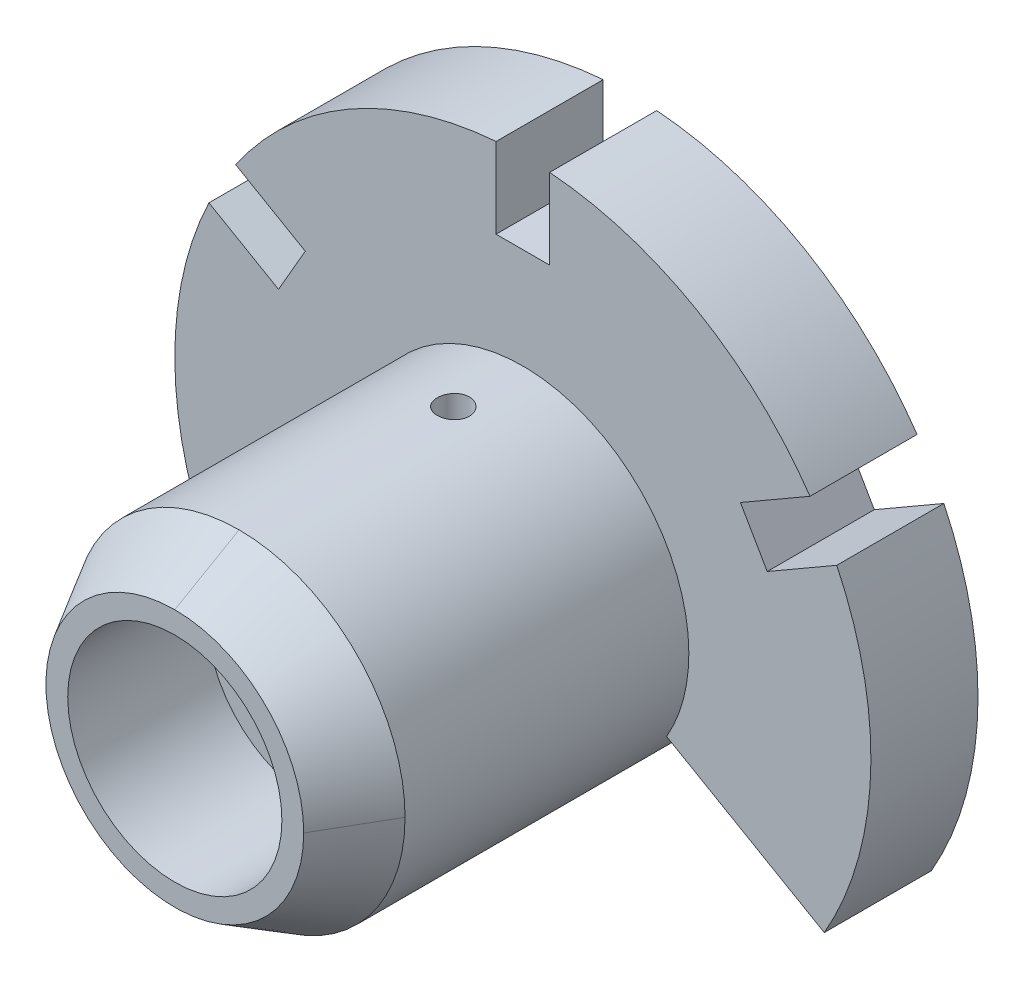
from build123d import *

# Parameters (mm, degrees)
BOSS_EXTRUDE1_DEPTH      = 20
BOSS_EXTRUDE2_DEPTH      = 65
BOSS_EXTRUDE2_DEPTH_BACK = 20
SKETCH3_R                = 31
SKETCH3_R_2              = 12.5
SKETCH6_R                = 20
CUT_EXTRUDE1_DEPTH       = 26
SKETCH8_R                = 12.5
CUT_EXTRUDE2_DEPTH       = 20
SKETCH9_R                = 3
CUT_EXTRUDE3_DEPTH       = 33


with BuildPart() as part:
    # Sketch2 → Boss-Extrude1 (new body)
    with BuildSketch(Plane.XY):
        with BuildLine():
            Line((0, 0), (56.291651246, -32.5))
            ThreePointArc((56.291651246, -32.5), (64.9518339, -2.501853916), (58.624860802, 28.073576473))
            Line((58.624860802, 28.073576473), (45.634479745, 20.573576473))
            Line((45.634479745, 20.573576473), (40.634479745, 29.233830511))
            Line((40.634479745, 29.233830511), (53.624860802, 36.733830511))
            ThreePointArc((53.624860802, 36.733830511), (32.5, 56.291651246), (5, 64.807406984))
            Line((5, 64.807406984), (5, 49.807406984))
            Line((5, 49.807406984), (-5, 49.807406984))
            Line((-5, 49.807406984), (-5, 64.807406984))
            ThreePointArc((-5, 64.807406984), (-32.5, 56.291651246), (-53.624860802, 36.733830511))
            Line((-53.624860802, 36.733830511), (-40.634479745, 29.233830511))
            Line((-40.634479745, 29.233830511), (-45.634479745, 20.573576473))
            Line((-45.634479745, 20.573576473), (-58.624860802, 28.073576473))
            ThreePointArc((-58.624860802, 28.073576473), (-64.9518339, -2.501853916), (-56.291651246, -32.5))
            Line((-56.291651246, -32.5), (0, 0))
        make_face()
    extrude(amount=BOSS_EXTRUDE1_DEPTH)

    # Sketch3 → Boss-Extrude2 (add, two sides: drawn at the far end of the back side and taken through both)
    with BuildSketch(Plane.XY.offset(20).offset(-BOSS_EXTRUDE2_DEPTH_BACK)):
        Circle(SKETCH3_R)
        Circle(SKETCH3_R_2, mode=Mode.SUBTRACT)
    extrude(amount=BOSS_EXTRUDE2_DEPTH + BOSS_EXTRUDE2_DEPTH_BACK)

    # Cut-Sweep1: sweep along a curve in space
    with BuildLine() as cut_sweep1_path:
        ThreePointArc((31, 0, 85), (21.920310217, 21.920310217, 85), (0, 31, 85))
        ThreePointArc((0, 31, 85), (-21.920310217, 21.920310217, 85), (-31, 0, 85))
        ThreePointArc((-31, 0, 85), (-21.920310217, -21.920310217, 85), (0, -31, 85))
        ThreePointArc((0, -31, 85), (21.920310217, -21.920310217, 85), (31, 0, 85))
    # Sketch5 → Cut-Sweep1 (sweep, cut)
    with BuildSketch(Plane(origin=(0, 0, 0), x_dir=(0, 0, -1), z_dir=(1, 0, 0))):
        Polygon((-85, 31), (-73, 31), (-85, 24.07179677), align=None)
    sweep(path=cut_sweep1_path.line, mode=Mode.SUBTRACT)

    # Sketch6 → Cut-Extrude1 (cut)
    with BuildSketch(Plane.XY.offset(85)):
        Circle(SKETCH6_R)
    extrude(amount=-CUT_EXTRUDE1_DEPTH, mode=Mode.SUBTRACT)

    # Sketch8 → Cut-Extrude2 (cut)
    with BuildSketch(Plane.XY.offset(20)):
        Circle(SKETCH8_R)
    extrude(amount=-CUT_EXTRUDE2_DEPTH, mode=Mode.SUBTRACT)

    # Sketch9 → Cut-Extrude3 (cut)
    with BuildSketch(Plane(origin=(0, 0, 0), x_dir=(1, 0, 0), z_dir=(0, 1, 0))):
        with Locations(Location((0, -33, 0), (0, 0, 90))):
            Circle(SKETCH9_R)
    extrude(amount=CUT_EXTRUDE3_DEPTH, mode=Mode.SUBTRACT)


solid = part.part
